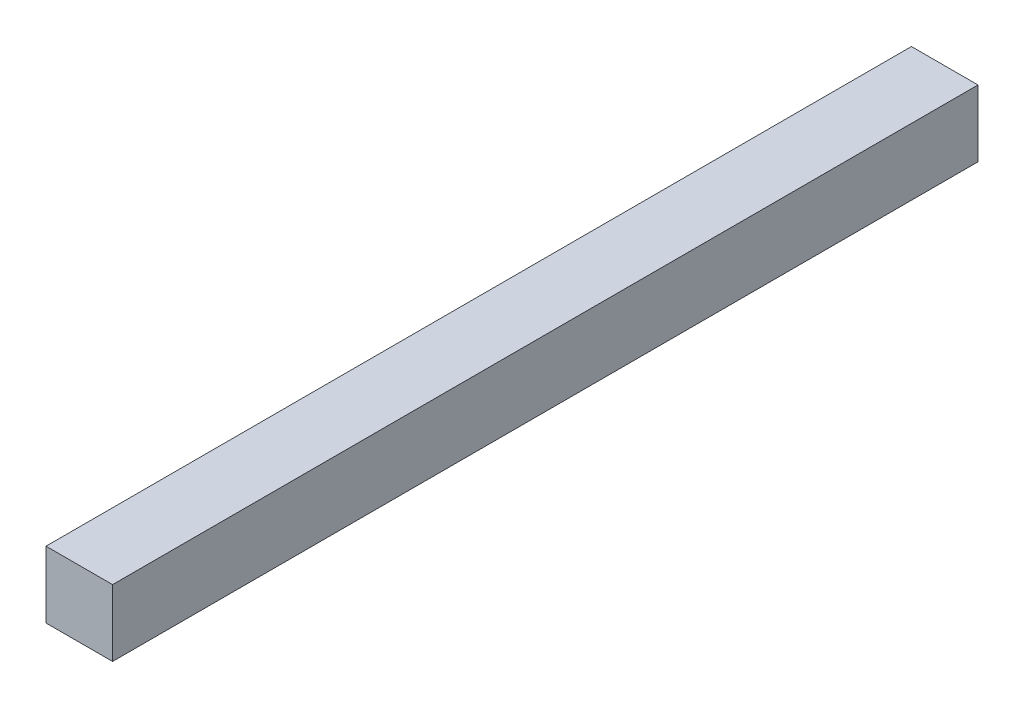
from build123d import *

# Parameters (mm, degrees)
SKETCH1_W           = 6.35
SKETCH1_H           = 6.35
BOSS_EXTRUDE1_DEPTH = 82.55


with BuildPart() as part:
    # Sketch1 → Boss-Extrude1 (new body)
    with BuildSketch(Plane.XY):
        with Locations((3.175, 3.175)):
            Rectangle(SKETCH1_W, SKETCH1_H)
    extrude(amount=BOSS_EXTRUDE1_DEPTH)


solid = part.part
